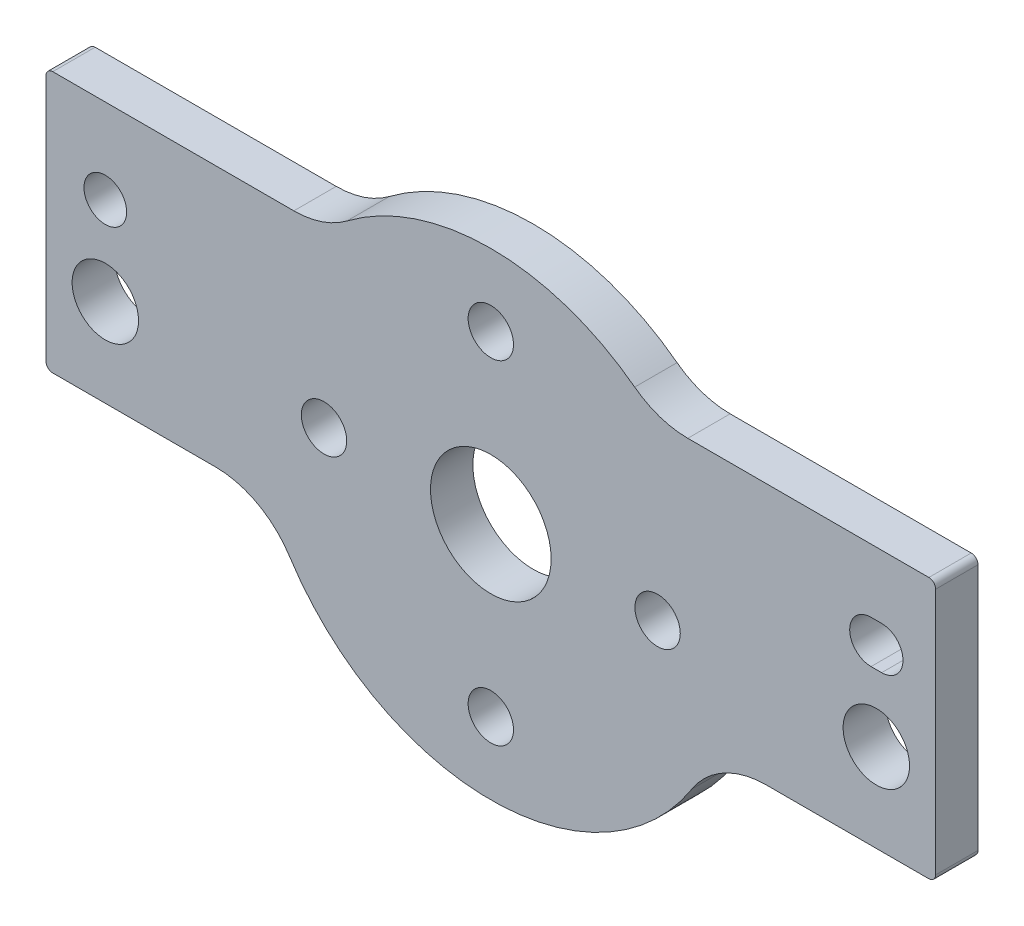
from build123d import *

# Parameters (mm, degrees)
SKETCH1_W              = 66.675
SKETCH1_H              = 13.208
BOSS_EXTRUDE1_DEPTH    = 3.175
SKETCH2_R              = 17.9
BOSS_EXTRUDE2_DEPTH    = 3.175
SKETCH8_W              = 66.675
SKETCH8_H              = 6.35
BOSS_EXTRUDE3_DEPTH    = 3.175
FILLET1_R              = 6.604
FILLET2_R              = 0.508
F_10_CLEARANCE_HOLE1_D = 4.9784
SKETCH5_R              = 4.5212
CUT_EXTRUDE1_DEPTH     = 38.972088845
M3_CLEARANCE_HOLE1_D   = 3.4
SKETCH9_R              = 1.6002
CUT_EXTRUDE2_DEPTH     = 38.972088845


with BuildPart() as part:
    # Sketch1 → Boss-Extrude1 (new body)
    with BuildSketch(Plane.XY):
        Rectangle(SKETCH1_W, SKETCH1_H)
    extrude(amount=BOSS_EXTRUDE1_DEPTH)

    # Sketch2 → Boss-Extrude2 (add, through all)
    with BuildSketch(Plane.XY.offset(3.175)):
        Circle(SKETCH2_R)
    extrude(amount=-BOSS_EXTRUDE2_DEPTH)

    # Sketch8 → Boss-Extrude3 (add, through all)
    with BuildSketch(Plane.XY.offset(3.175)):
        with Locations((0, 9.779)):
            Rectangle(SKETCH8_W, SKETCH8_H)
    extrude(amount=-BOSS_EXTRUDE3_DEPTH)

    # Fillet1
    fillet1_edges = [part.edges().sort_by_distance(p)[0] for p in [
        (-16.637222845, -6.604, 1.5875),
        (16.637222845, -6.604, 1.5875),
        (12.353294459, 12.954, 1.5875),
        (-12.353294459, 12.954, 1.5875),
    ]]
    fillet(fillet1_edges, radius=FILLET1_R)

    # Fillet2
    fillet2_edges = [part.edges().sort_by_distance(p)[0] for p in [
        (-33.3375, 12.954, 1.5875),
        (33.3375, 12.954, 1.5875),
        (33.3375, -6.604, 1.5875),
        (-33.3375, -6.604, 1.5875),
    ]]
    fillet(fillet2_edges, radius=FILLET2_R)

    # #10 Clearance Hole1 (through all)
    with Locations(Plane.XY.offset(3.175)):
        with Locations((28.8925, 0), (-28.8925, 0)):
            Hole(F_10_CLEARANCE_HOLE1_D / 2)

    # Sketch5 → Cut-Extrude1 (cut, through all)
    with BuildSketch(Plane.XY.offset(3.175)):
        Circle(SKETCH5_R)
    extrude(amount=-CUT_EXTRUDE1_DEPTH, mode=Mode.SUBTRACT)

    # M3 Clearance Hole1 (through all)
    with Locations(Plane.XY.offset(3.175)):
        with Locations((0, 12.5), (-12.5, 0), (0, -12.5), (12.5, 0)):
            Hole(M3_CLEARANCE_HOLE1_D / 2)

    # Sketch9 → Cut-Extrude2 (cut, through all)
    with BuildSketch(Plane.XY.offset(3.175)):
        with Locations((-28.8925, 6.604)):
            Circle(SKETCH9_R)
        with BuildLine():
            Line((28.495625, 8.2042), (29.289375, 8.2042))
            ThreePointArc((29.289375, 8.2042), (30.889575, 6.604), (29.289375, 5.0038))
            Line((29.289375, 5.0038), (28.495625, 5.0038))
            ThreePointArc((28.495625, 5.0038), (26.895425, 6.604), (28.495625, 8.2042))
        make_face()
    extrude(amount=-CUT_EXTRUDE2_DEPTH, mode=Mode.SUBTRACT)


solid = part.part
